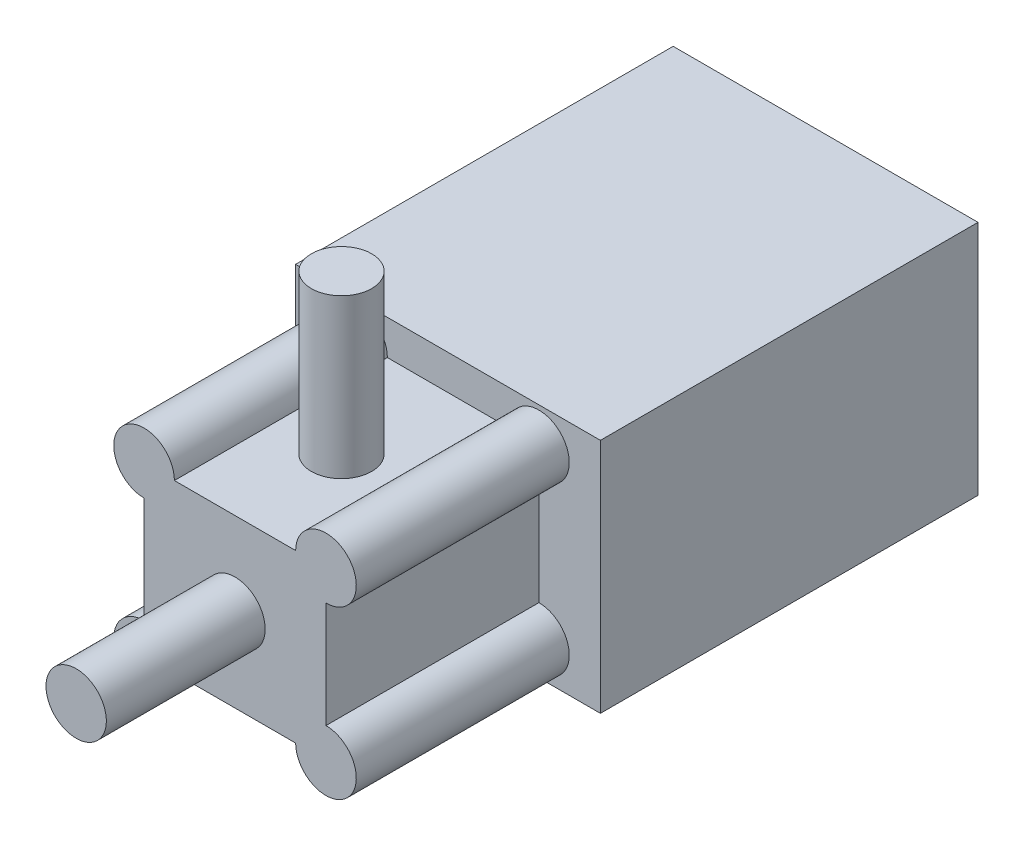
from build123d import *

# Parameters (mm, degrees)
SKETCH1_W           = 20.11
SKETCH1_H           = 15.6
BOSS_EXTRUDE1_DEPTH = 24.91
SKETCH2_R           = 2
SKETCH2_W           = 12
SKETCH2_H           = 11
BOSS_EXTRUDE2_DEPTH = 14.05
SKETCH3_R           = 1.99
BOSS_EXTRUDE3_DEPTH = 10.45
SKETCH4_R           = 1.99
BOSS_EXTRUDE4_DEPTH = 10.48


with BuildPart() as part:
    # Sketch1 → Boss-Extrude1 (new body)
    with BuildSketch(Plane.XY):
        Rectangle(SKETCH1_W, SKETCH1_H)
    extrude(amount=BOSS_EXTRUDE1_DEPTH)

    # Sketch2 → Boss-Extrude2 (add)
    with BuildSketch(Plane.XY.offset(24.91)):
        with BuildLine():
            ThreePointArc((-4, 5.5), (-7.414213562, 6.914213562), (-6, 3.5))
            Line((-6, 3.5), (-6, 5.5))
            Line((-6, 5.5), (-4, 5.5))
        make_face()
        with BuildLine():
            Line((-6, 5.5), (-6, 3.5))
            ThreePointArc((-6, 3.5), (-4.585786438, 4.085786438), (-4, 5.5))
            Line((-4, 5.5), (-6, 5.5))
        make_face()
        with Locations((-6, -5.5)):
            Circle(SKETCH2_R)
        with Locations((6, -5.5)):
            Circle(SKETCH2_R)
        with Locations((6, 5.5)):
            Circle(SKETCH2_R)
        with Locations((-6, 5.5)):
            Circle(SKETCH2_R)
        Rectangle(SKETCH2_W, SKETCH2_H)
        with BuildLine():
            ThreePointArc((4, 5.5), (4.585786438, 4.085786438), (6, 3.5))
            Line((6, 3.5), (6, 5.5))
            Line((6, 5.5), (4, 5.5))
        make_face()
        with BuildLine():
            Line((6, 5.5), (6, 3.5))
            ThreePointArc((6, 3.5), (7.414213562, 4.085786438), (8, 5.5))
            ThreePointArc((8, 5.5), (6, 7.5), (4, 5.5))
            Line((4, 5.5), (6, 5.5))
        make_face()
        with BuildLine():
            ThreePointArc((6, -3.5), (4.585786438, -4.085786438), (4, -5.5))
            Line((4, -5.5), (6, -5.5))
            Line((6, -5.5), (6, -3.5))
        make_face()
        with BuildLine():
            Line((6, -5.5), (4, -5.5))
            ThreePointArc((4, -5.5), (6, -7.5), (8, -5.5))
            ThreePointArc((8, -5.5), (7.414213562, -4.085786438), (6, -3.5))
            Line((6, -3.5), (6, -5.5))
        make_face()
        with BuildLine():
            ThreePointArc((-6, -3.5), (-7.414213562, -6.914213562), (-4, -5.5))
            Line((-4, -5.5), (-6, -5.5))
            Line((-6, -5.5), (-6, -3.5))
        make_face()
        with BuildLine():
            Line((-6, -5.5), (-4, -5.5))
            ThreePointArc((-4, -5.5), (-4.585786438, -4.085786438), (-6, -3.5))
            Line((-6, -3.5), (-6, -5.5))
        make_face()
    extrude(amount=BOSS_EXTRUDE2_DEPTH)

    # Sketch3 → Boss-Extrude3 (add)
    with BuildSketch(Plane(origin=(0, 5.5, 0), x_dir=(1, 0, 0), z_dir=(0, 1, 0))):
        with Locations((0, -31.935)):
            Circle(SKETCH3_R)
    extrude(amount=BOSS_EXTRUDE3_DEPTH)

    # Sketch4 → Boss-Extrude4 (add)
    with BuildSketch(Plane.XY.offset(38.96)):
        with Locations(Location((0, 0, 0), (0, 0, 180))):
            Circle(SKETCH4_R)
    extrude(amount=BOSS_EXTRUDE4_DEPTH)


solid = part.part
